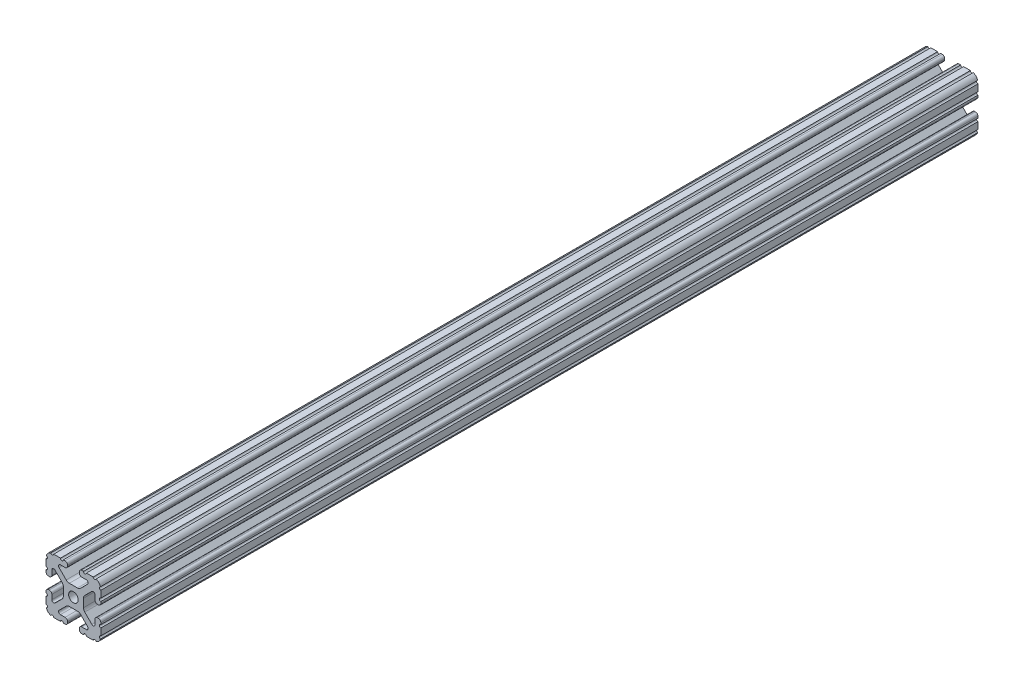
from build123d import *

# Parameters (mm, degrees)
BOSS_EXTRUDE1_DEPTH     = 304.8
CUT_EXTRUDE1_DEPTH      = 306.9883086
CUT_EXTRUDE1_DEPTH_BACK = 306.9883086
SKETCH5_R               = 1.016


with BuildPart() as part:
    # Sketch4 → Boss-Extrude1 (new, symmetric)
    with BuildSketch(Plane.XY):
        with BuildLine():
            Line((5.7912, -19.05), (14.3002, -19.05))
            ThreePointArc((14.3002, -19.05), (17.658815789, -17.658815789), (19.05, -14.3002))
            Line((19.05, -14.3002), (19.05, -5.7912))
            ThreePointArc((19.05, -5.7912), (18.544114832, -4.569885168), (17.3228, -4.064))
            Line((17.3228, -4.064), (16.7132, -4.064))
            ThreePointArc((16.7132, -4.064), (15.491885168, -4.569885168), (14.986, -5.7912))
            Line((14.986, -5.7912), (14.986, -8.996305235))
            ThreePointArc((14.986, -8.996305235), (14.189232738, -10.188751711), (12.782646215, -9.908964256))
            Line((12.782646215, -9.908964256), (7.888897763, -5.015215804))
            ThreePointArc((7.888897763, -5.015215804), (7.219915375, -4.014012907), (6.985, -2.833013566))
            Line((6.985, -2.833013566), (6.985, 0))
            Line((6.985, 0), (3.3274, 0))
            ThreePointArc((3.3274, 0), (2.352827104, -2.352827104), (0, -3.3274))
            Line((0, -3.3274), (0, -6.985))
            Line((0, -6.985), (2.833013566, -6.985))
            ThreePointArc((2.833013566, -6.985), (4.014012907, -7.219915375), (5.015215804, -7.888897763))
            Line((5.015215804, -7.888897763), (9.908964256, -12.782646215))
            ThreePointArc((9.908964256, -12.782646215), (10.188751711, -14.189232738), (8.996305235, -14.986))
            Line((8.996305235, -14.986), (5.7912, -14.986))
            ThreePointArc((5.7912, -14.986), (4.569885168, -15.491885168), (4.064, -16.7132))
            Line((4.064, -16.7132), (4.064, -17.3228))
            ThreePointArc((4.064, -17.3228), (4.569885168, -18.544114832), (5.7912, -19.05))
        make_face()
    extrude(amount=BOSS_EXTRUDE1_DEPTH, both=True)

    # Sketch5 → Cut-Extrude1 (cut, two sides: drawn at the far end of the back side and taken through both)
    with BuildSketch(Plane.XY.offset(-CUT_EXTRUDE1_DEPTH_BACK)):
        with Locations((14.739477062, -19.05)):
            Circle(SKETCH5_R)
        with Locations((7.980305235, -19.05)):
            Circle(SKETCH5_R)
        with Locations((19.05, -14.739477062)):
            Circle(SKETCH5_R)
        with Locations((19.05, -7.980305235)):
            Circle(SKETCH5_R)
    extrude(amount=CUT_EXTRUDE1_DEPTH + CUT_EXTRUDE1_DEPTH_BACK, mode=Mode.SUBTRACT)

    # Mirror1: part across plane


with BuildPart() as part_1:
    add(part.part)
    add(part.part.mirror(Plane(origin=(0, 0, 0), x_dir=(0, 0, 1), z_dir=(1, 0, 0))))

    # Mirror2: part across plane


with BuildPart() as part_2:
    add(part_1.part)
    add(part_1.part.mirror(Plane.ZX))


solid = part_2.part
